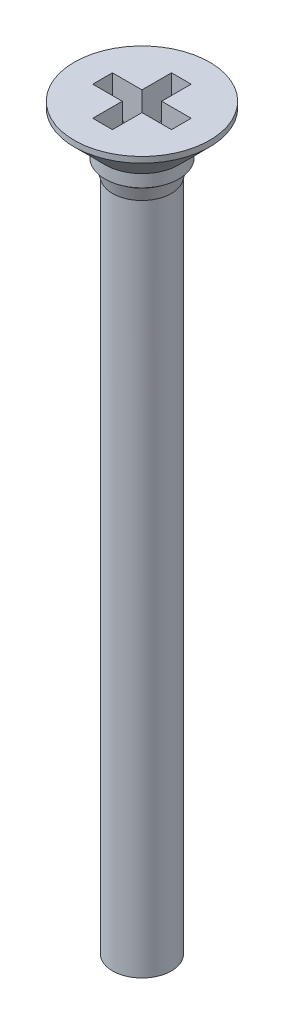
from build123d import *

# Parameters (mm, degrees)
KREUZSCHLITZ1_H_DEPTH      = 0.4
KREUZSCHLITZ1_H_DEPTH_BACK = 0.4
KREUZSCHLITZ2_H_DEPTH      = 0.4
KREUZSCHLITZ2_H_DEPTH_BACK = 0.4
BOSS_EXTRUDE1_START        = 22
SKETCH1_R                  = 1.1935
BOSS_EXTRUDE1_DEPTH        = 22


with BuildPart() as part:
    # Skizze1 → Basis-Rotation (revolve)
    with BuildSketch(Plane.XY, mode=Mode.PRIVATE) as basis_rotation_sk:
        Polygon((0, 0), (2.75, 0), (2.75, -0.2375), (1.5, -1.4875), (1.5, -1.9875), (1.3375, -1.9875), (1.3375, -2.112584684), (1.1935, -2.65), (1.1935, -8), (0, -8), align=None)
    revolve(basis_rotation_sk.sketch.rotate(Axis((0, 0, 0), (0, -1, 0)), 180), axis=Axis((0, 0, 0), (0, -1, 0)))

    # Skizze2 → Kreuzschlitz1 H (cut, two sides: drawn at the far end of the back side and taken through both)
    with BuildSketch(Plane.XY.offset(-KREUZSCHLITZ1_H_DEPTH_BACK)):
        Polygon((-0.55, -2.1), (0.55, -2.1), (1.6, -1.05), (1.6, 0), (-1.6, 0), (-1.6, -1.05), align=None)
    extrude(amount=KREUZSCHLITZ1_H_DEPTH + KREUZSCHLITZ1_H_DEPTH_BACK, mode=Mode.SUBTRACT)

    # Skizze3 → Kreuzschlitz2 H (cut, two sides: drawn at the far end of the back side and taken through both)
    with BuildSketch(Plane(origin=(0, 0, 0), x_dir=(0, 0, -1), z_dir=(1, 0, 0)).offset(-KREUZSCHLITZ2_H_DEPTH_BACK)):
        Polygon((-0.55, -2.1), (0.55, -2.1), (1.6, -1.05), (1.6, 0), (-1.6, 0), (-1.6, -1.05), align=None)
    extrude(amount=KREUZSCHLITZ2_H_DEPTH + KREUZSCHLITZ2_H_DEPTH_BACK, mode=Mode.SUBTRACT)

    # Sketch1 → Boss-Extrude1 (add)
    with BuildSketch(Plane.XZ.offset(8).offset(BOSS_EXTRUDE1_START)):
        with Locations(Location((0, 0, 0), (0, 0, 180))):
            Circle(SKETCH1_R)
    extrude(amount=-BOSS_EXTRUDE1_DEPTH)


solid = part.part
